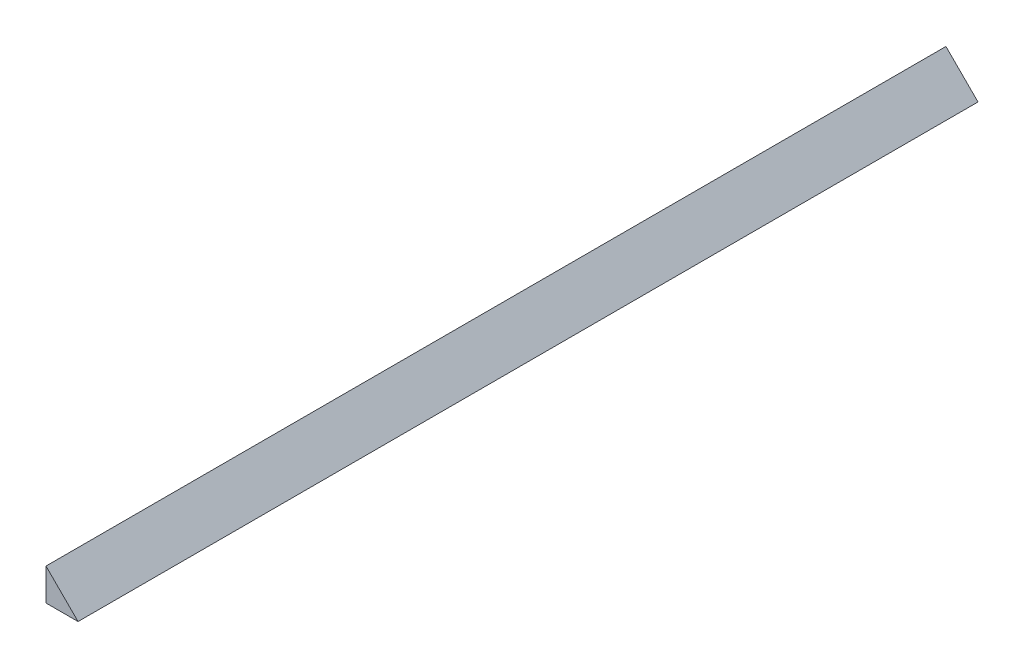
from build123d import *

# Parameters (mm, degrees)
BOSS_EXTRUDE1_DEPTH = 73


with BuildPart() as part:
    # Sketch1 → Boss-Extrude1 (new body)
    with BuildSketch(Plane.XY):
        Polygon((0, 0), (2.6, 0), (0, 2.6), align=None)
    extrude(amount=-BOSS_EXTRUDE1_DEPTH)


solid = part.part
